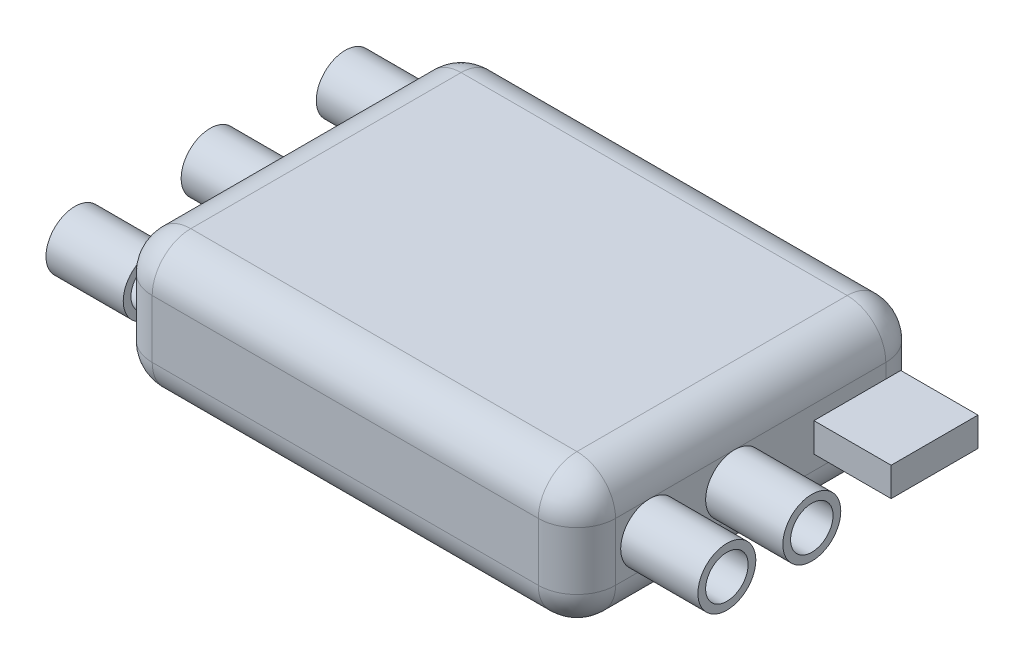
from build123d import *

# Parameters (mm, degrees)
BOSS_EXTRUDE1_DEPTH = 7
FILLET1_R           = 2
SKETCH2_R           = 1.5
SKETCH2_R_2         = 1.1
BOSS_EXTRUDE2_DEPTH = 4
SKETCH3_R           = 1.5
SKETCH3_R_2         = 1.1
SKETCH3_W           = 4.5
SKETCH3_H           = 1.5
BOSS_EXTRUDE3_DEPTH = 4


with BuildPart() as part:
    # Sketch1 → Boss-Extrude1 (new body)
    with BuildSketch(Plane(origin=(0, 0, 0), x_dir=(1, 0, 0), z_dir=(0, 1, 0))):
        with BuildLine():
            Line((10, 9), (-10, 9))
            ThreePointArc((-10, 9), (-11.414213562, 8.414213562), (-12, 7))
            Line((-12, 7), (-12, -7))
            ThreePointArc((-12, -7), (-11.414213562, -8.414213562), (-10, -9))
            Line((-10, -9), (10, -9))
            ThreePointArc((10, -9), (11.414213562, -8.414213562), (12, -7))
            Line((12, -7), (12, 7))
            ThreePointArc((12, 7), (11.414213562, 8.414213562), (10, 9))
        make_face()
    extrude(amount=BOSS_EXTRUDE1_DEPTH)

    # Fillet1
    fillet1_edges = [part.edges().sort_by_distance(p)[0] for p in [
        (12, 0, 0),
        (11.414213562, 0, 8.414213562),
        (0, 0, 9),
        (-11.414213562, 0, 8.414213562),
        (11.414213562, 7, 8.414213562),
        (12, 7, 0),
        (11.414213562, 7, -8.414213562),
        (0, 7, -9),
        (-11.414213562, 7, -8.414213562),
        (-12, 7, 0),
        (-11.414213562, 7, 8.414213562),
        (-12, 0, 0),
        (0, 7, 9),
        (-11.414213562, 0, -8.414213562),
        (0, 0, -9),
        (11.414213562, 0, -8.414213562),
    ]]
    fillet(fillet1_edges, radius=FILLET1_R)

    # Sketch2 → Boss-Extrude2 (add)
    # profile 1 of 3: a face of its own
    with BuildSketch(Plane.ZY.offset(12)):
        with Locations(Location((0, 3.5, 0), (0, 0, 270))):
            Circle(SKETCH2_R)
        with Locations((0, 3.5)):
            Circle(SKETCH2_R_2, mode=Mode.SUBTRACT)
    # profile 2 of 3: a face of its own
    with BuildSketch(Plane.ZY.offset(12)):
        with Locations(Location((7, 3.5, 0), (0, 0, 270))):
            Circle(SKETCH2_R)
        with Locations(Location((7, 3.5, 0), (0, 0, 90))):
            Circle(SKETCH2_R_2, mode=Mode.SUBTRACT)
    # profile 3 of 3: a face of its own
    with BuildSketch(Plane.ZY.offset(12)):
        with Locations(Location((-7, 3.5, 0), (0, 0, 270))):
            Circle(SKETCH2_R)
        with Locations(Location((-7, 3.5, 0), (0, 0, 90))):
            Circle(SKETCH2_R_2, mode=Mode.SUBTRACT)
    extrude(amount=BOSS_EXTRUDE2_DEPTH)

    # Sketch3 → Boss-Extrude3 (add)
    # profile 1 of 3: a face of its own
    with BuildSketch(Plane(origin=(12, 0, 0), x_dir=(0, 0, -1), z_dir=(1, 0, 0))):
        with Locations(Location((-5.233431742, 3.5, 0), (0, 0, 270))):
            Circle(SKETCH3_R)
        with Locations((-5.233431742, 3.5)):
            Circle(SKETCH3_R_2, mode=Mode.SUBTRACT)
    # profile 2 of 3: a face of its own
    with BuildSketch(Plane(origin=(12, 0, 0), x_dir=(0, 0, -1), z_dir=(1, 0, 0))):
        with Locations(Location((-0.833431742, 3.5, 0), (0, 0, 270))):
            Circle(SKETCH3_R)
        with Locations((-0.833431742, 3.5)):
            Circle(SKETCH3_R_2, mode=Mode.SUBTRACT)
    # profile 3 of 3: a face of its own
    with BuildSketch(Plane(origin=(12, 0, 0), x_dir=(0, 0, -1), z_dir=(1, 0, 0))):
        with Locations((5.52417795, 3.5)):
            Rectangle(SKETCH3_W, SKETCH3_H)
    extrude(amount=BOSS_EXTRUDE3_DEPTH)


solid = part.part
